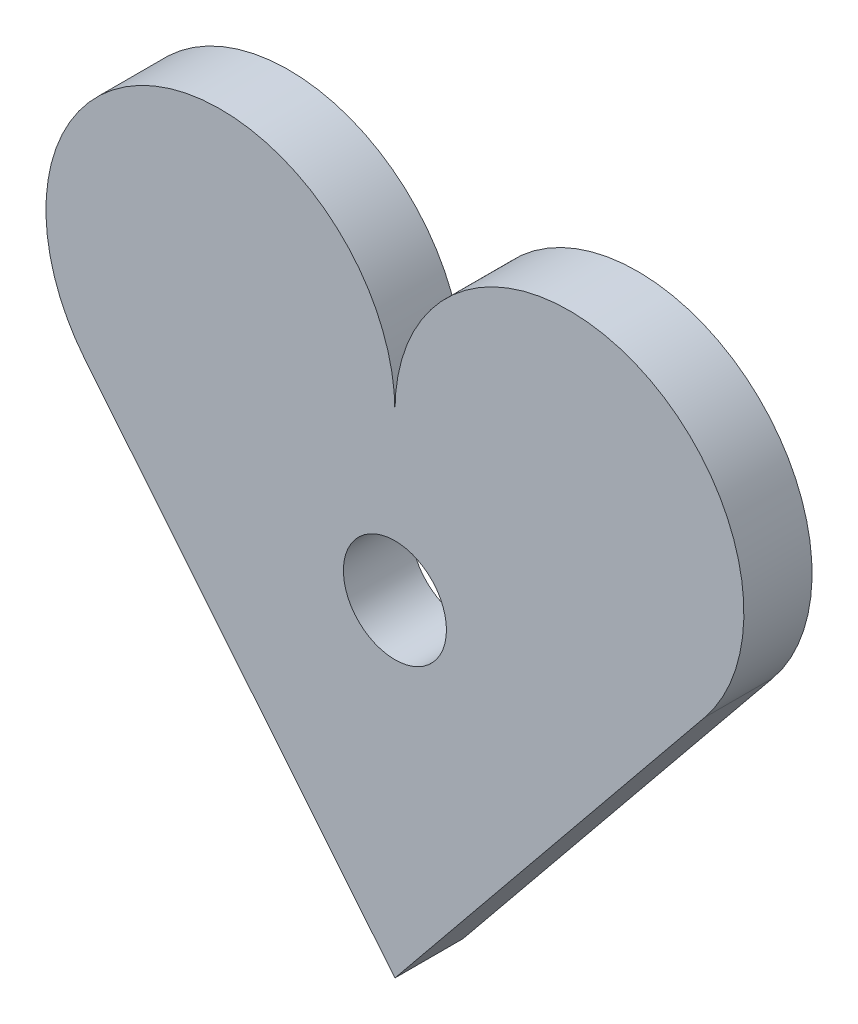
from build123d import *

# Parameters (mm, degrees)
BOSS_EXTRUDE1_START = 7.62
SKETCH1_R           = 2.4
BOSS_EXTRUDE1_DEPTH = 3.175


with BuildPart() as part:
    # Sketch1 → Boss-Extrude1 (new body)
    with BuildSketch(Plane.XY.offset(BOSS_EXTRUDE1_START)):
        with BuildLine():
            Line((-6.580283468, 85.746774073), (7.851281635, 68.017997221))
            Line((7.851281635, 68.017997221), (22.282846738, 85.746774073))
            ThreePointArc((22.282846738, 85.746774073), (18.702240214, 98.536318224), (7.851281635, 90.877997221))
            ThreePointArc((7.851281635, 90.877997221), (-2.999676943, 98.536318224), (-6.580283468, 85.746774073))
        make_face()
        with Locations((7.851281635, 83.257997221)):
            Circle(SKETCH1_R, mode=Mode.SUBTRACT)
    extrude(amount=BOSS_EXTRUDE1_DEPTH)


solid = part.part
